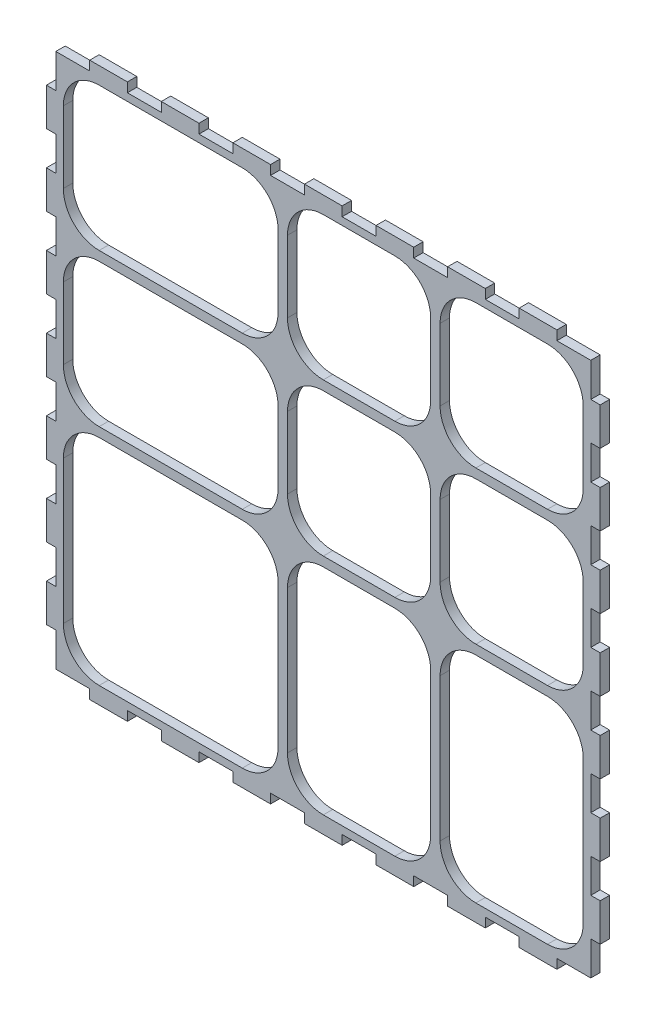
from build123d import *

# Parameters (mm, degrees)
BOSS_EXTRUDE1_DEPTH = 2.5


with BuildPart() as part:
    # Sketch1 → Boss-Extrude1 (new body)
    with BuildSketch(Plane.XY):
        Polygon((-73.5, 0), (-73.5, 5), (-71, 5), (-71, 14), (-73.5, 14), (-73.5, 24), (-71, 24), (-71, 33), (-73.5, 33), (-73.5, 43), (-71, 43), (-71, 52), (-73.5, 52), (-73.5, 62), (-71, 62), (-71, 71), (-62, 71), (-62, 73.5), (-52, 73.5), (-52, 71), (-43, 71), (-43, 73.5), (-33, 73.5), (-33, 71), (-24, 71), (-24, 73.5), (-14, 73.5), (-14, 71), (-5, 71), (-5, 73.5), (5, 73.5), (5, 71), (14, 71), (14, 73.5), (24, 73.5), (24, 71), (33, 71), (33, 73.5), (43, 73.5), (43, 71), (52, 71), (52, 73.5), (62, 73.5), (62, 71), (71, 71), (71, 62), (73.5, 62), (73.5, 52), (71, 52), (71, 43), (73.5, 43), (73.5, 33), (71, 33), (71, 24), (73.5, 24), (73.5, 14), (71, 14), (71, 5), (73.5, 5), (73.5, 0), (73.5, -5), (71, -5), (71, -14), (73.5, -14), (73.5, -24), (71, -24), (71, -33), (73.5, -33), (73.5, -43), (71, -43), (71, -52), (73.5, -52), (73.5, -62), (71, -62), (71, -71), (62, -71), (62, -73.5), (52, -73.5), (52, -71), (43, -71), (43, -73.5), (33, -73.5), (33, -71), (24, -71), (24, -73.5), (14, -73.5), (14, -71), (5, -71), (5, -73.5), (-5, -73.5), (-5, -71), (-14, -71), (-14, -73.5), (-24, -73.5), (-24, -71), (-33, -71), (-33, -73.5), (-43, -73.5), (-43, -71), (-52, -71), (-52, -73.5), (-62, -73.5), (-62, -71), (-71, -71), (-71, -62), (-73.5, -62), (-73.5, -52), (-71, -52), (-71, -43), (-73.5, -43), (-73.5, -33), (-71, -33), (-71, -24), (-73.5, -24), (-73.5, -14), (-71, -14), (-71, -5), (-73.5, -5), align=None)
        with BuildLine():
            Line((-9.5, 59.5), (-9.5, 40.5))
            ThreePointArc((-9.5, 40.5), (-6.717514421, 33.782485579), (0, 31))
            Line((0, 31), (19, 31))
            ThreePointArc((19, 31), (25.717514421, 33.782485579), (28.5, 40.5))
            Line((28.5, 40.5), (28.5, 59.5))
            ThreePointArc((28.5, 59.5), (25.717514421, 66.217514421), (19, 69))
            Line((19, 69), (0, 69))
            ThreePointArc((0, 69), (-6.717514421, 66.217514421), (-9.5, 59.5))
        make_face(mode=Mode.SUBTRACT)
        with BuildLine():
            Line((40.5, 69), (59.5, 69))
            ThreePointArc((59.5, 69), (66.217514421, 66.217514421), (69, 59.5))
            Line((69, 59.5), (69, 40.5))
            ThreePointArc((69, 40.5), (66.217514421, 33.782485579), (59.5, 31))
            Line((59.5, 31), (40.5, 31))
            ThreePointArc((40.5, 31), (33.782485579, 33.782485579), (31, 40.5))
            Line((31, 40.5), (31, 59.5))
            ThreePointArc((31, 59.5), (33.782485579, 66.217514421), (40.5, 69))
        make_face(mode=Mode.SUBTRACT)
        with BuildLine():
            Line((-9.5, 19), (-9.5, 0))
            ThreePointArc((-9.5, 0), (-6.717514421, -6.717514421), (0, -9.5))
            Line((0, -9.5), (19, -9.5))
            ThreePointArc((19, -9.5), (25.717514421, -6.717514421), (28.5, 0))
            Line((28.5, 0), (28.5, 19))
            ThreePointArc((28.5, 19), (25.717514421, 25.717514421), (19, 28.5))
            Line((19, 28.5), (0, 28.5))
            ThreePointArc((0, 28.5), (-6.717514421, 25.717514421), (-9.5, 19))
        make_face(mode=Mode.SUBTRACT)
        with BuildLine():
            Line((31, 19), (31, 0))
            ThreePointArc((31, 0), (33.782485579, -6.717514421), (40.5, -9.5))
            Line((40.5, -9.5), (59.5, -9.5))
            ThreePointArc((59.5, -9.5), (66.217514421, -6.717514421), (69, 0))
            Line((69, 0), (69, 19))
            ThreePointArc((69, 19), (66.217514421, 25.717514421), (59.5, 28.5))
            Line((59.5, 28.5), (40.5, 28.5))
            ThreePointArc((40.5, 28.5), (33.782485579, 25.717514421), (31, 19))
        make_face(mode=Mode.SUBTRACT)
        with BuildLine():
            Line((-69, 19), (-69, 0))
            ThreePointArc((-69, 0), (-66.217514421, -6.717514421), (-59.5, -9.5))
            Line((-59.5, -9.5), (-21.5, -9.5))
            ThreePointArc((-21.5, -9.5), (-14.782485579, -6.717514421), (-12, 0))
            Line((-12, 0), (-12, 19))
            ThreePointArc((-12, 19), (-14.782485579, 25.717514421), (-21.5, 28.5))
            Line((-21.5, 28.5), (-59.5, 28.5))
            ThreePointArc((-59.5, 28.5), (-66.217514421, 25.717514421), (-69, 19))
        make_face(mode=Mode.SUBTRACT)
        with BuildLine():
            Line((-59.5, 69), (-21.5, 69))
            ThreePointArc((-21.5, 69), (-14.782485579, 66.217514421), (-12, 59.5))
            Line((-12, 59.5), (-12, 40.5))
            ThreePointArc((-12, 40.5), (-14.782485579, 33.782485579), (-21.5, 31))
            Line((-21.5, 31), (-59.5, 31))
            ThreePointArc((-59.5, 31), (-66.217514421, 33.782485579), (-69, 40.5))
            Line((-69, 40.5), (-69, 59.5))
            ThreePointArc((-69, 59.5), (-66.217514421, 66.217514421), (-59.5, 69))
        make_face(mode=Mode.SUBTRACT)
        with BuildLine():
            Line((-9.5, -21.5), (-9.5, -59.5))
            ThreePointArc((-9.5, -59.5), (-6.717514421, -66.217514421), (0, -69))
            Line((0, -69), (19, -69))
            ThreePointArc((19, -69), (25.717514421, -66.217514421), (28.5, -59.5))
            Line((28.5, -59.5), (28.5, -21.5))
            ThreePointArc((28.5, -21.5), (25.717514421, -14.782485579), (19, -12))
            Line((19, -12), (0, -12))
            ThreePointArc((0, -12), (-6.717514421, -14.782485579), (-9.5, -21.5))
        make_face(mode=Mode.SUBTRACT)
        with BuildLine():
            Line((40.5, -12), (59.5, -12))
            ThreePointArc((59.5, -12), (66.217514421, -14.782485579), (69, -21.5))
            Line((69, -21.5), (69, -59.5))
            ThreePointArc((69, -59.5), (66.217514421, -66.217514421), (59.5, -69))
            Line((59.5, -69), (40.5, -69))
            ThreePointArc((40.5, -69), (33.782485579, -66.217514421), (31, -59.5))
            Line((31, -59.5), (31, -21.5))
            ThreePointArc((31, -21.5), (33.782485579, -14.782485579), (40.5, -12))
        make_face(mode=Mode.SUBTRACT)
        with BuildLine():
            Line((-59.5, -12), (-21.5, -12))
            ThreePointArc((-21.5, -12), (-14.782485579, -14.782485579), (-12, -21.5))
            Line((-12, -21.5), (-12, -59.5))
            ThreePointArc((-12, -59.5), (-14.782485579, -66.217514421), (-21.5, -69))
            Line((-21.5, -69), (-59.5, -69))
            ThreePointArc((-59.5, -69), (-66.217514421, -66.217514421), (-69, -59.5))
            Line((-69, -59.5), (-69, -21.5))
            ThreePointArc((-69, -21.5), (-66.217514421, -14.782485579), (-59.5, -12))
        make_face(mode=Mode.SUBTRACT)
    extrude(amount=BOSS_EXTRUDE1_DEPTH)


solid = part.part
